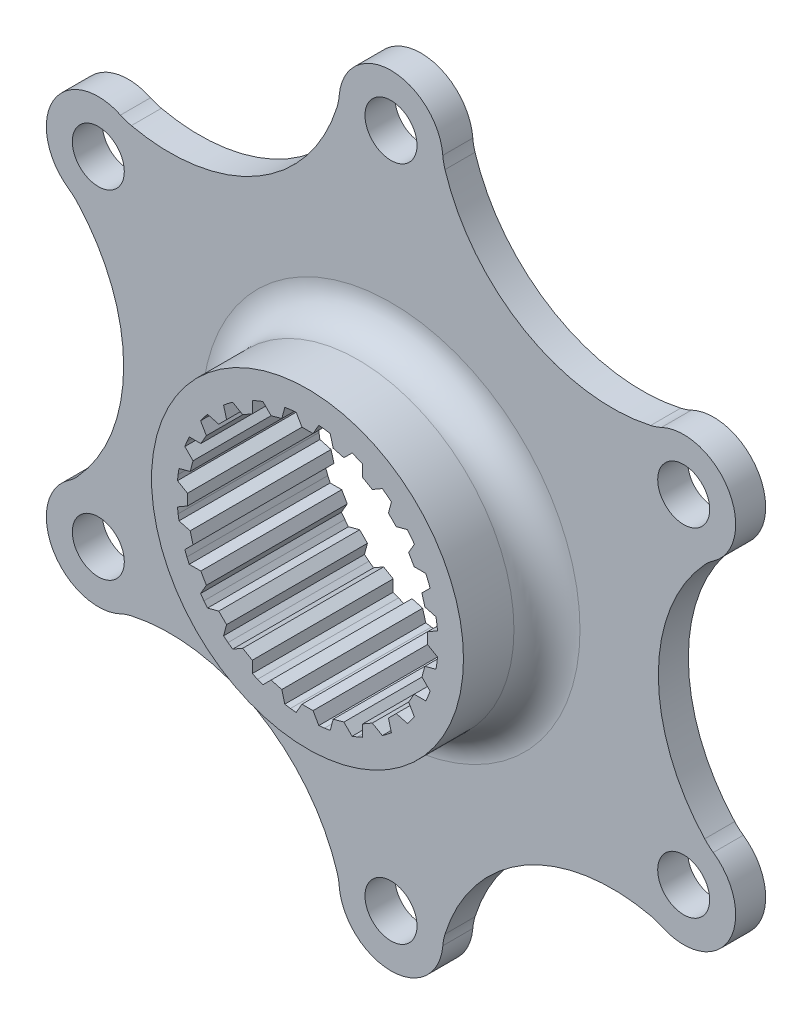
from build123d import *

# Parameters (mm, degrees)
SKETCH1_R           = 100
BOSS_EXTRUDE1_DEPTH = 13.55
CUT_EXTRUDE1_DEPTH  = 144.994479061
SKETCH3_R           = 88
SKETCH3_R_2         = 30
CUT_EXTRUDE13_DEPTH = 16.06
FILLET1_R           = 6.35
CUT_EXTRUDE14_START = -5.27
SKETCH7_R           = 88
SKETCH7_R_2         = 30
CUT_EXTRUDE14_DEPTH = 5.27
FILLET2_R           = 3.175
SKETCH8_R           = 100
SKETCH8_R_2         = 88
CUT_EXTRUDE17_DEPTH = 144.994479061
SKETCH9_R           = 5
CUT_EXTRUDE20_DEPTH = 10
SKETCH10_R          = 88
CUT_EXTRUDE21_DEPTH = 10
FILLET3_R           = 10


with BuildPart() as part:
    # Sketch1 → Boss-Extrude1 (new, symmetric)
    with BuildSketch(Plane.XY):
        Circle(SKETCH1_R)
    extrude(amount=BOSS_EXTRUDE1_DEPTH, both=True)

    # Sketch2 → Cut-Extrude1 (cut, through all)
    with BuildSketch(Plane.XY.offset(13.55)):
        Polygon((2.179683155, 25.005179098), (1.065531645, 23.075412075), (0, 23.075412075), (-1.065531645, 23.075412075), (-2.179683155, 25.005179098), (-3.276207429, 24.885266027), (-4.366404331, 24.717291793), (-4.943131584, 22.564916358), (-7.001580653, 22.013356593), (-8.577228829, 23.589004769), (-9.605354152, 23.189376274), (-10.614928564, 22.744961902), (-10.614928564, 20.516658882), (-12.460483511, 19.451127237), (-14.390250533, 20.565278747), (-15.27991187, 19.913168849), (-16.140062965, 19.222600444), (-15.563335705, 17.070225009), (-17.070225009, 15.563335705), (-19.222600444, 16.140062965), (-19.913168845, 15.279911875), (-20.565278747, 14.390250533), (-19.451127237, 12.460483511), (-20.516658882, 10.614928564), (-22.744961902, 10.614928564), (-23.189376271, 9.605354159), (-23.589004769, 8.577228829), (-22.013356593, 7.001580653), (-22.564916358, 4.943131584), (-24.717291794, 4.366404324), (-24.885266027, 3.276207429), (-25.005179098, 2.179683155), (-23.075412075, 1.065531645), (-23.075412075, -1.065531645), (-25.005179098, -2.179683155), (-24.885266028, -3.276207422), (-24.717291794, -4.366404324), (-22.564916358, -4.943131584), (-22.013356593, -7.001580653), (-23.589004769, -8.577228829), (-23.189376274, -9.605354152), (-22.744961902, -10.614928564), (-20.516658882, -10.614928564), (-19.451127237, -12.460483511), (-20.565278747, -14.390250533), (-19.913168849, -15.27991187), (-19.222600444, -16.140062965), (-17.070225009, -15.563335705), (-15.563335705, -17.070225009), (-16.140062965, -19.222600444), (-15.279911875, -19.913168845), (-14.390250533, -20.565278747), (-12.460483511, -19.451127237), (-10.614928564, -20.516658882), (-10.614928564, -22.744961902), (-9.605354159, -23.189376271), (-8.577228829, -23.589004769), (-7.001580653, -22.013356593), (-4.943131584, -22.564916358), (-4.366404324, -24.717291794), (-3.276207429, -24.885266027), (-2.179683155, -25.005179098), (-1.065531645, -23.075412075), (1.065531645, -23.075412075), (2.179683155, -25.005179098), (3.276207422, -24.885266028), (4.366404324, -24.717291794), (4.943131584, -22.564916358), (7.001580653, -22.013356593), (8.577228829, -23.589004769), (9.605354152, -23.189376274), (10.614928564, -22.744961902), (10.614928564, -20.516658882), (12.460483511, -19.451127237), (14.390250533, -20.565278747), (15.27991187, -19.913168849), (16.140062965, -19.222600444), (15.563335705, -17.070225009), (17.070225009, -15.563335705), (19.222600444, -16.140062965), (19.913168845, -15.279911875), (20.565278747, -14.390250533), (19.451127237, -12.460483511), (20.516658882, -10.614928564), (22.744961902, -10.614928564), (23.189376271, -9.605354159), (23.589004769, -8.577228829), (22.013356593, -7.001580653), (22.564916358, -4.943131584), (24.717291794, -4.366404324), (24.885266027, -3.276207429), (25.005179098, -2.179683155), (23.075412075, -1.065531645), (23.075412075, 1.065531645), (25.005179098, 2.179683155), (24.885266028, 3.276207422), (24.717291794, 4.366404324), (22.564916358, 4.943131584), (22.013356593, 7.001580653), (23.589004769, 8.577228829), (23.189376274, 9.605354152), (22.744961902, 10.614928564), (20.516658882, 10.614928564), (19.451127237, 12.460483511), (20.565278747, 14.390250533), (19.913168849, 15.27991187), (19.222600444, 16.140062965), (17.070225009, 15.563335705), (15.563335705, 17.070225009), (16.140062965, 19.222600444), (15.279911876, 19.913168845), (14.390250533, 20.565278747), (12.460483511, 19.451127237), (10.614928564, 20.516658882), (10.614928564, 22.744961902), (9.605354159, 23.189376271), (8.577228829, 23.589004769), (7.001580653, 22.013356593), (4.943131584, 22.564916358), (4.366404324, 24.717291794), (3.276207429, 24.885266027), align=None)
    extrude(amount=-CUT_EXTRUDE1_DEPTH, mode=Mode.SUBTRACT)

    # Sketch3 → Cut-Extrude13 (cut)
    with BuildSketch(Plane.XY.offset(13.55)):
        Circle(SKETCH3_R)
        Circle(SKETCH3_R_2, mode=Mode.SUBTRACT)
    extrude(amount=-CUT_EXTRUDE13_DEPTH, mode=Mode.SUBTRACT)

    # Fillet1
    fillet1_edges = [part.edges().sort_by_distance(p)[0] for p in [
        (-30, 0, -2.51),
    ]]
    fillet(fillet1_edges, radius=FILLET1_R)

    # Sketch7 → Cut-Extrude14 (cut)
    with BuildSketch(Plane(origin=(0, 0, -13.55), x_dir=(-1, 0, 0), z_dir=(0, 0, -1)).offset(CUT_EXTRUDE14_START)):
        Circle(SKETCH7_R)
        Circle(SKETCH7_R_2, mode=Mode.SUBTRACT)
    extrude(amount=CUT_EXTRUDE14_DEPTH, mode=Mode.SUBTRACT)

    # Fillet2
    fillet2_edges = [part.edges().sort_by_distance(p)[0] for p in [
        (30, 0, -8.28),
    ]]
    fillet(fillet2_edges, radius=FILLET2_R)

    # Sketch8 → Cut-Extrude17 (cut, through all)
    with BuildSketch(Plane(origin=(0, 0, -13.55), x_dir=(-1, 0, 0), z_dir=(0, 0, -1))):
        Circle(SKETCH8_R)
        Circle(SKETCH8_R_2, mode=Mode.SUBTRACT)
    extrude(amount=-CUT_EXTRUDE17_DEPTH, mode=Mode.SUBTRACT)

    # Sketch9 → Cut-Extrude20 (cut)
    with BuildSketch(Plane(origin=(0, 0, -8.28), x_dir=(-1, 0, 0), z_dir=(0, 0, -1))):
        with Locations((0, 65)):
            Circle(SKETCH9_R)
        with Locations((56.291651246, 32.5)):
            Circle(SKETCH9_R)
        with Locations((56.291651246, -32.5)):
            Circle(SKETCH9_R)
        with Locations((0, -65)):
            Circle(SKETCH9_R)
        with Locations((-56.291651246, -32.5)):
            Circle(SKETCH9_R)
        with Locations((-56.291651246, 32.5)):
            Circle(SKETCH9_R)
    extrude(amount=-CUT_EXTRUDE20_DEPTH, mode=Mode.SUBTRACT)

    # Sketch10 → Cut-Extrude21 (cut)
    with BuildSketch(Plane(origin=(0, 0, -8.28), x_dir=(-1, 0, 0), z_dir=(0, 0, -1))):
        Circle(SKETCH10_R)
        with BuildLine():
            ThreePointArc((-61.291651246, 23.839745962), (-64.951905284, 37.5), (-51.291651246, 41.160254038))
            ThreePointArc((-51.291651246, 41.160254038), (-25.708452572, 44.528346039), (-10, 65))
            ThreePointArc((-10, 65), (0, 75), (10, 65))
            ThreePointArc((10, 65), (25.708452572, 44.528346039), (51.291651246, 41.160254038))
            ThreePointArc((51.291651246, 41.160254038), (61.291651246, 41.160254038), (66.291651246, 32.5))
            ThreePointArc((66.291651246, 32.5), (64.951905284, 27.5), (61.291651246, 23.839745962))
            ThreePointArc((61.291651246, 23.839745962), (51.416905145, 0), (61.291651246, -23.839745962))
            ThreePointArc((61.291651246, -23.839745962), (64.951905284, -27.5), (66.291651246, -32.5))
            ThreePointArc((66.291651246, -32.5), (61.291651246, -41.160254038), (51.291651246, -41.160254038))
            ThreePointArc((51.291651246, -41.160254038), (25.708452572, -44.528346039), (10, -65))
            ThreePointArc((10, -65), (0, -75), (-10, -65))
            ThreePointArc((-10, -65), (-25.708452572, -44.528346039), (-51.291651246, -41.160254038))
            ThreePointArc((-51.291651246, -41.160254038), (-64.951905284, -37.5), (-61.291651246, -23.839745962))
            ThreePointArc((-61.291651246, -23.839745962), (-51.416905145, 0), (-61.291651246, 23.839745962))
        make_face(mode=Mode.SUBTRACT)
    extrude(amount=-CUT_EXTRUDE21_DEPTH, mode=Mode.SUBTRACT)

    # Fillet3
    fillet3_edges = [part.edges().sort_by_distance(p)[0] for p in [
        (-51.291651246, -41.160254038, -5.395),
        (-61.291651246, -23.839745962, -5.395),
        (-61.291651246, 23.839745962, -5.395),
        (-51.291651246, 41.160254038, -5.395),
        (-10, 65, -5.395),
        (10, 65, -5.395),
        (51.291651246, 41.160254038, -5.395),
        (61.291651246, 23.839745962, -5.395),
        (61.291651246, -23.839745962, -5.395),
        (51.291651246, -41.160254038, -5.395),
        (10, -65, -5.395),
        (-10, -65, -5.395),
    ]]
    fillet(fillet3_edges, radius=FILLET3_R)


solid = part.part
